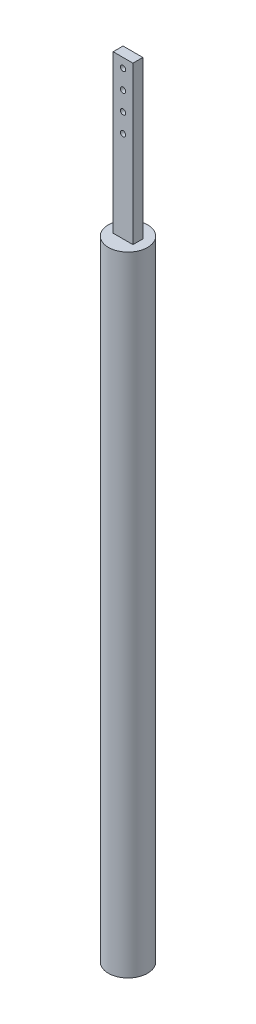
from build123d import *

# Parameters (mm, degrees)
SKETCH1_R           = 3.9624
BOSS_EXTRUDE1_DEPTH = 127
SKETCH4_W           = 4.000000128
SKETCH4_H           = 2
BOSS_EXTRUDE2_DEPTH = 31.75
SKETCH5_R           = 0.5334
CUT_EXTRUDE1_DEPTH  = 2


with BuildPart() as part:
    # Sketch1 → Boss-Extrude1 (new body)
    with BuildSketch(Plane(origin=(0, 0, 0), x_dir=(1, 0, 0), z_dir=(0, 1, 0))):
        with Locations(Location((0, 0, 0), (0, 0, 270))):
            Circle(SKETCH1_R)
    extrude(amount=BOSS_EXTRUDE1_DEPTH)

    # Sketch4 → Boss-Extrude2 (add)
    with BuildSketch(Plane(origin=(0, 127, 0), x_dir=(1, 0, 0), z_dir=(0, 1, 0))):
        with Locations((6.4e-08, 0)):
            Rectangle(SKETCH4_W, SKETCH4_H)
    extrude(amount=BOSS_EXTRUDE2_DEPTH)

    # Sketch5 → Cut-Extrude1 (cut)
    with BuildSketch(Plane(origin=(0, 0, -1), x_dir=(-1, 0, 0), z_dir=(0, 0, -1))):
        with Locations((0, 156.845)):
            Circle(SKETCH5_R)
        with Locations((0, 153.035)):
            Circle(SKETCH5_R)
        with Locations((0, 149.225)):
            Circle(SKETCH5_R)
        with Locations((0, 145.415)):
            Circle(SKETCH5_R)
    extrude(amount=-CUT_EXTRUDE1_DEPTH, mode=Mode.SUBTRACT)


solid = part.part
